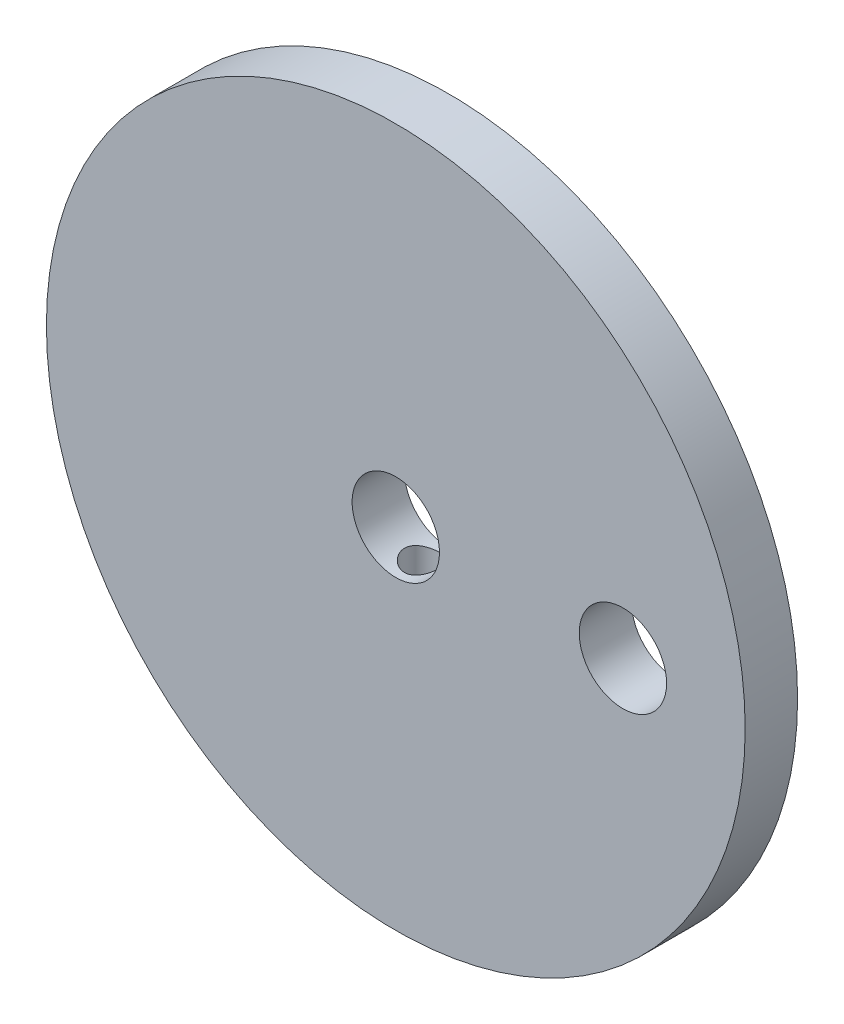
from build123d import *

# Parameters (mm, degrees)
SKETCH_1_R          = 20
EXTRUDE_1_DEPTH     = 3
SKETCH_2_R          = 2.5
CUT_EXTRUDE_1_DEPTH = 29.442925307
SKETCH_4_R          = 2.5
CUT_EXTRUDE_2_DEPTH = 29.442925307
F_2_0MM_1_REACH     = 46.747
F_2_0MM_1_BORE_R    = 1


with BuildPart() as part:
    # 草图1 → 凸台-拉伸1 (new body)
    with BuildSketch(Plane.XY):
        Circle(SKETCH_1_R)
    extrude(amount=EXTRUDE_1_DEPTH)

    # 草图2 → 切除-拉伸1 (cut, through all)
    with BuildSketch(Plane.XY.offset(3)):
        Circle(SKETCH_2_R)
    extrude(amount=-CUT_EXTRUDE_1_DEPTH, mode=Mode.SUBTRACT)

    # 草图4 → 切除-拉伸2 (cut, through all)
    with BuildSketch(Plane.XY.offset(3)):
        with Locations((13, 0)):
            Circle(SKETCH_4_R)
    extrude(amount=-CUT_EXTRUDE_2_DEPTH, mode=Mode.SUBTRACT)

    # Ø2.0mm 暗销孔1 bore (on position points) → Ø2.0mm 暗销孔1 (cut, up to next)
    with BuildSketch(Plane(origin=(0, -20, 1.5), x_dir=(-1, 0, 0), z_dir=(0, -1, 0)), mode=Mode.PRIVATE) as f_2_0mm_1_sk1:
        Circle(F_2_0MM_1_BORE_R)
    f_2_0mm_1_tool1 = extrude(f_2_0mm_1_sk1.sketch, amount=-F_2_0MM_1_REACH, mode=Mode.PRIVATE) & part.part
    add(f_2_0mm_1_tool1.solids().sort_by_distance((0, -20, 1.5))[0], mode=Mode.SUBTRACT)


solid = part.part
